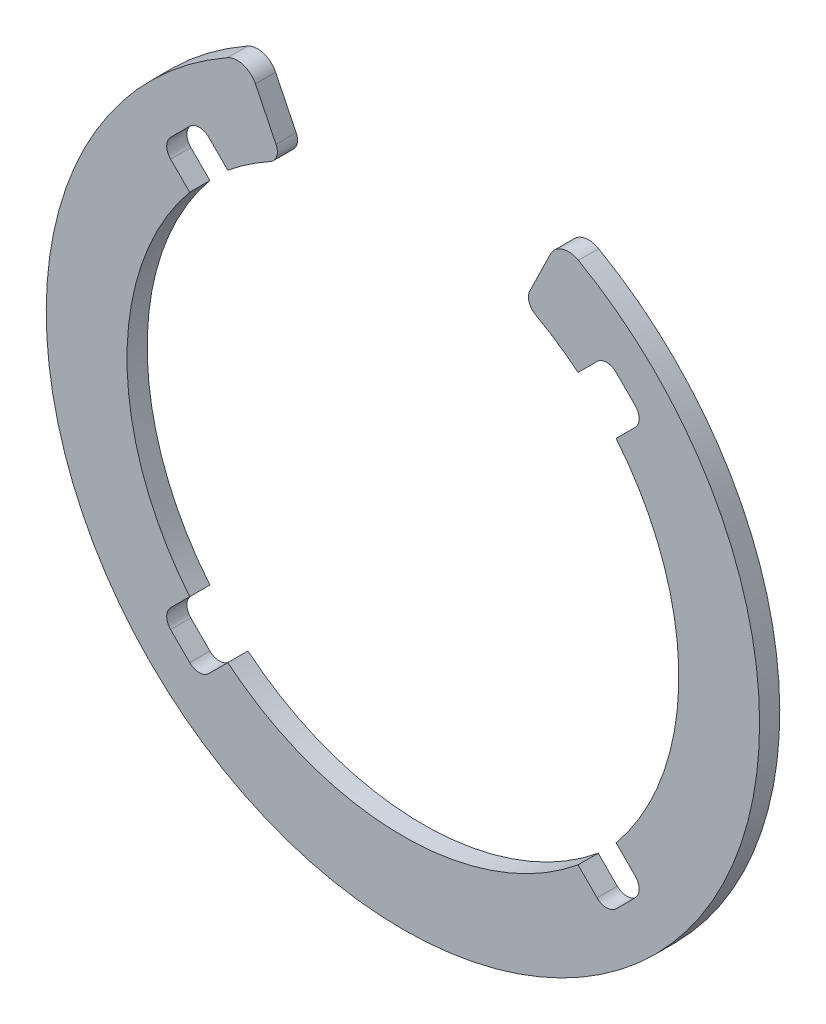
from build123d import *

# Parameters (mm, degrees)
ESQUISSE1_R                  = 53
ESQUISSE1_R_2                = 41
BOSS_EXTRU_1_DEPTH           = 3
ENL_V_MAT_EXTRU_1_DEPTH      = 76.013332148
ENL_V_MAT_EXTRU_1_DEPTH_BACK = 76.013332148
ENL_V_MAT_EXTRU_2_DEPTH      = 76.013332148
ENL_V_MAT_EXTRU_2_DEPTH_BACK = 76.013332148
CONG_1_R                     = 3
CONG_2_R                     = 2


with BuildPart() as part:
    # Esquisse1 → Boss.-Extru.1 (new body)
    with BuildSketch(Plane.XY):
        Circle(ESQUISSE1_R)
        Circle(ESQUISSE1_R_2, mode=Mode.SUBTRACT)
    extrude(amount=BOSS_EXTRU_1_DEPTH)

    # Esquisse2 → Enlèv. mat.-Extru.1 (cut, two sides: drawn at the far end of the back side and taken through both)
    with BuildSketch(Plane.XY.offset(3).offset(-ENL_V_MAT_EXTRU_1_DEPTH_BACK)):
        with BuildLine():
            Line((-18, 36.837480913), (-23.268292683, 47.619182643))
            ThreePointArc((-23.268292683, 47.619182643), (0, 53), (23.268292683, 47.619182643))
            Line((23.268292683, 47.619182643), (18, 36.837480913))
            ThreePointArc((18, 36.837480913), (0, 41), (-18, 36.837480913))
        make_face()
    extrude(amount=ENL_V_MAT_EXTRU_1_DEPTH + ENL_V_MAT_EXTRU_1_DEPTH_BACK, mode=Mode.SUBTRACT)

    # Esquisse3 → Enlèv. mat.-Extru.2 (cut, two sides: drawn at the far end of the back side and taken through both)
    with BuildSketch(Plane.XY.offset(3).offset(-ENL_V_MAT_EXTRU_2_DEPTH_BACK)):
        Polygon((26.024648968, -31.681503217), (31.681503217, -26.024648968), (35.924143904, -30.267289655), (30.267289655, -35.924143904), align=None)
        Polygon((-26.024648968, -31.681503217), (-30.267289655, -35.924143904), (-35.924143904, -30.267289655), (-31.681503217, -26.024648968), align=None)
        Polygon((-26.024648968, 31.681503217), (-31.681503217, 26.024648968), (-35.924143904, 30.267289655), (-30.267289655, 35.924143904), align=None)
        Polygon((26.024648968, 31.681503217), (30.267289655, 35.924143904), (35.924143904, 30.267289655), (31.681503217, 26.024648968), align=None)
    extrude(amount=ENL_V_MAT_EXTRU_2_DEPTH + ENL_V_MAT_EXTRU_2_DEPTH_BACK, mode=Mode.SUBTRACT)

    # Congé1
    cong_1_edges = [part.edges().sort_by_distance(p)[0] for p in [
        (-23.268292683, 47.619182643, 1.5),
        (23.268292683, 47.619182643, 1.5),
    ]]
    fillet(cong_1_edges, radius=CONG_1_R)

    # Congé2
    cong_2_edges = [part.edges().sort_by_distance(p)[0] for p in [
        (18, 36.837480913, 1.5),
        (-18, 36.837480913, 1.5),
        (30.267289655, 35.924143904, 1.5),
        (35.924143904, 30.267289655, 1.5),
        (-30.267289655, 35.924143904, 1.5),
        (-35.924143904, 30.267289655, 1.5),
        (-30.267289655, -35.924143904, 1.5),
        (-35.924143904, -30.267289655, 1.5),
        (35.924143904, -30.267289655, 1.5),
        (30.267289655, -35.924143904, 1.5),
    ]]
    fillet(cong_2_edges, radius=CONG_2_R)


solid = part.part
